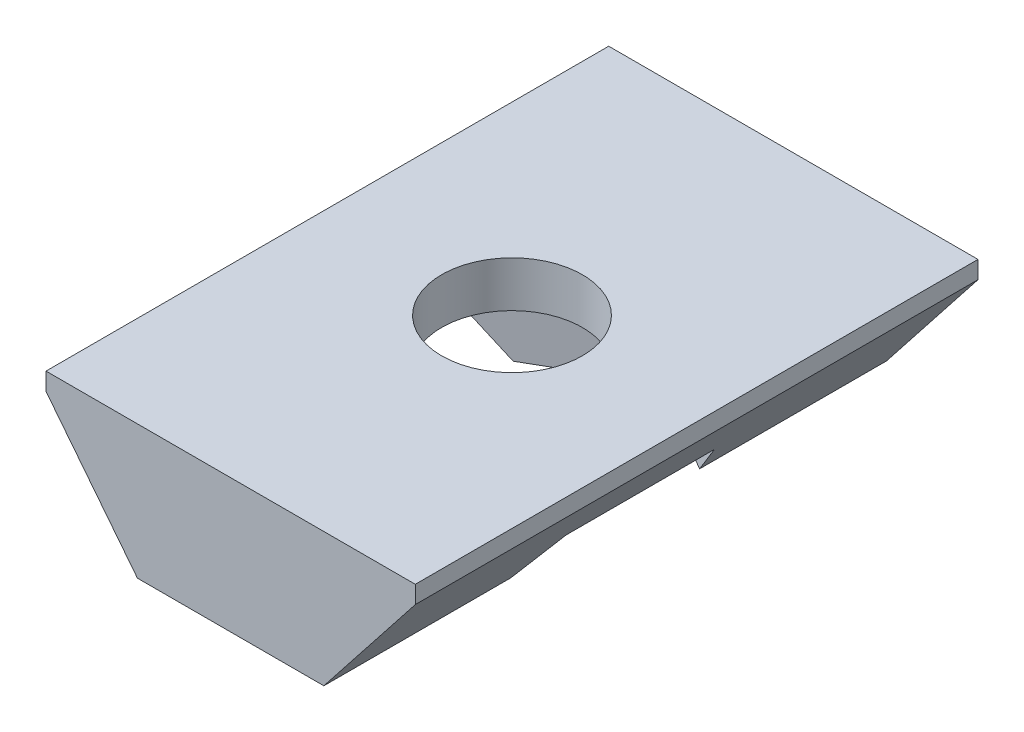
from build123d import *

# Parameters (mm, degrees)
RESSALTO_EXTRUS_O1_DEPTH   = 16
CORTE_EXTRUS_O1_DEPTH      = 18.262748912
CORTE_EXTRUS_O1_DEPTH_BACK = 18.262748912
ESBO_O2_R                  = 2
CORTE_EXTRUS_O2_DEPTH      = 2.5


with BuildPart() as part:
    # Esboço1 → Ressalto-extrusão1 (new body)
    with BuildSketch(Plane.XY):
        Polygon((-2.65, 0), (2.65, 0), (5.25, 3.3), (5.25, 3.8), (-5.25, 3.8), (-5.25, 3.3), align=None)
    extrude(amount=RESSALTO_EXTRUS_O1_DEPTH)

    # Esboço2 → Corte-extrusão1 (cut, two sides: drawn at the far end of the back side and taken through both)
    with BuildSketch(Plane(origin=(0, 3.8, 0), x_dir=(1, 0, 0), z_dir=(0, 1, 0)).offset(-CORTE_EXTRUS_O1_DEPTH_BACK)):
        with Locations(Location((0, -8, 0), (0, 0, 270))):
            Circle(ESBO_O2_R)
    extrude(amount=CORTE_EXTRUS_O1_DEPTH + CORTE_EXTRUS_O1_DEPTH_BACK, mode=Mode.SUBTRACT)

    # Esboço3 → Corte-extrusão2 (cut)
    with BuildSketch(Plane.XZ):
        Polygon((0, 12.214656965), (-3.65, 10.107328483), (-3.65, 5.892671517), (0, 3.785343035), (3.65, 5.892671517), (3.65, 10.107328483), align=None)
    extrude(amount=-CORTE_EXTRUS_O2_DEPTH, mode=Mode.SUBTRACT)


solid = part.part
